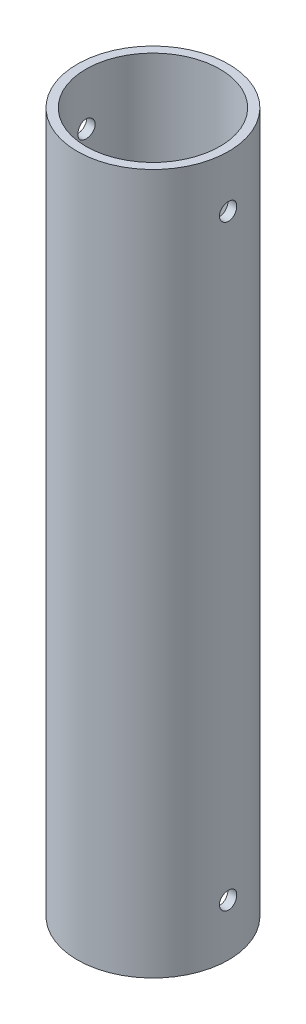
from build123d import *

# Parameters (mm, degrees)
ESQUISSE1_R                  = 17.5
ESQUISSE1_R_2                = 15.5
BOSS_EXTRU_1_DEPTH           = 162
ENL_V_MAT_EXTRU_1_DEPTH      = 164.879528923
ENL_V_MAT_EXTRU_1_DEPTH_BACK = 164.879528923
ESQUISSE2_R                  = 2


with BuildPart() as part:
    # Esquisse1 → Boss.-Extru.1 (new body)
    with BuildSketch(Plane(origin=(0, 0, 0), x_dir=(1, 0, 0), z_dir=(0, 1, 0))):
        with Locations(Location((0, 0, 0), (0, 0, 270))):
            Circle(ESQUISSE1_R)
        with Locations(Location((0, 0, 0), (0, 0, 270))):
            Circle(ESQUISSE1_R_2, mode=Mode.SUBTRACT)
    extrude(amount=BOSS_EXTRU_1_DEPTH)

    # Esquisse2 → Enlèv. mat.-Extru.1 (cut, two sides: drawn at the far end of the back side and taken through both)
    with BuildSketch(Plane(origin=(0, 0, 0), x_dir=(0, 0, -1), z_dir=(1, 0, 0)).offset(-ENL_V_MAT_EXTRU_1_DEPTH_BACK)):
        with Locations((0, 150)):
            Circle(ESQUISSE2_R)
        with Locations((0, 12)):
            Circle(ESQUISSE2_R)
    extrude(amount=ENL_V_MAT_EXTRU_1_DEPTH + ENL_V_MAT_EXTRU_1_DEPTH_BACK, mode=Mode.SUBTRACT)


solid = part.part
